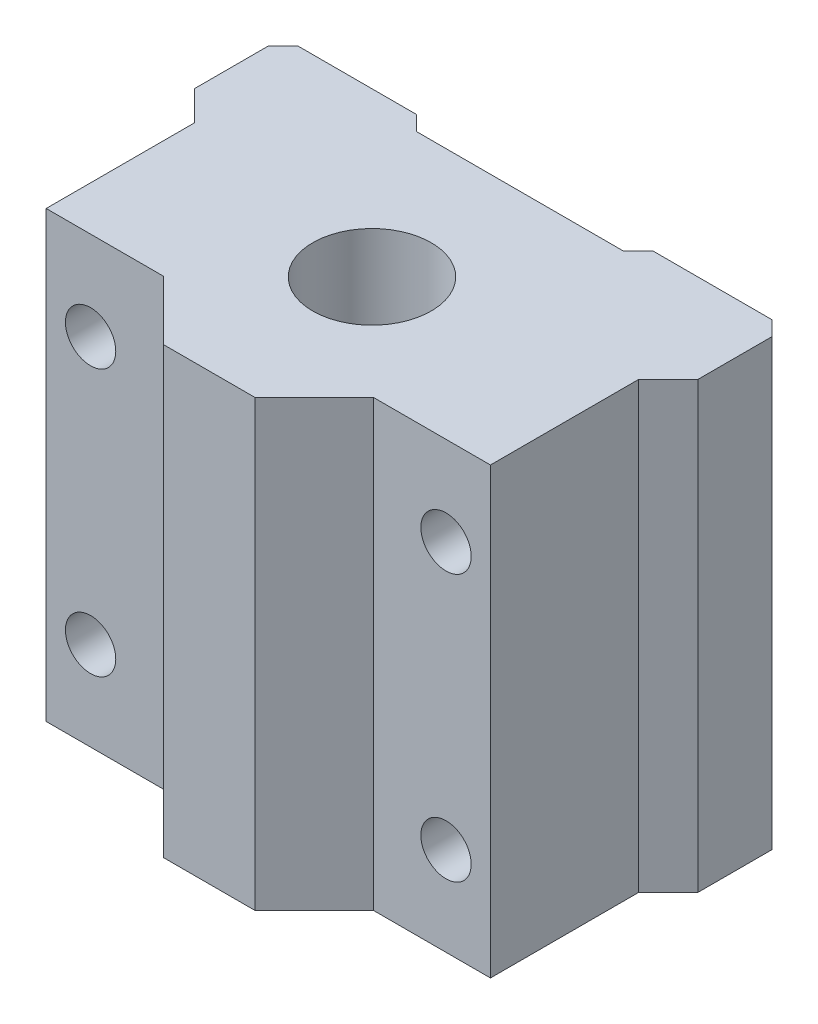
from build123d import *

# Parameters (mm, degrees)
SKETCH1_R           = 4
BOSS_EXTRUDE1_DEPTH = 30
SKETCH2_R           = 1.7
CUT_EXTRUDE1_DEPTH  = 18


with BuildPart() as part:
    # Sketch1 → Boss-Extrude1 (new body)
    with BuildSketch(Plane(origin=(0, 0, 0), x_dir=(1, 0, 0), z_dir=(0, 1, 0))):
        Polygon((-7, 10), (7, 10), (8, 11), (16, 11), (17, 10), (17, 5), (15, 3), (15, -7), (7.091285061, -7), (3.091285061, -11), (-3.091285061, -11), (-7.091285061, -7), (-15, -7), (-15, 3), (-17, 5), (-17, 10), (-16, 11), (-8, 11), align=None)
        with Locations(Location((0, 0, 0), (0, 0, 270))):
            Circle(SKETCH1_R, mode=Mode.SUBTRACT)
    extrude(amount=BOSS_EXTRUDE1_DEPTH)

    # Sketch2 → Cut-Extrude1 (cut)
    with BuildSketch(Plane.XY.offset(7)):
        with Locations((12, 24)):
            Circle(SKETCH2_R)
        with Locations((-12, 24)):
            Circle(SKETCH2_R)
        with Locations((-12, 6)):
            Circle(SKETCH2_R)
        with Locations((12, 6)):
            Circle(SKETCH2_R)
    extrude(amount=-CUT_EXTRUDE1_DEPTH, mode=Mode.SUBTRACT)


solid = part.part
